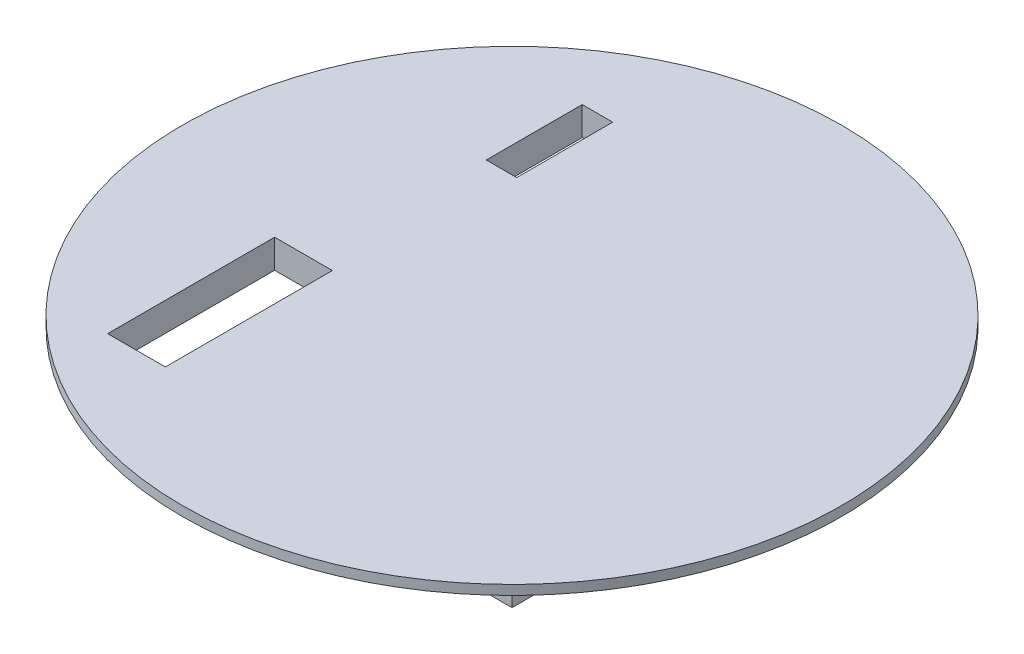
from build123d import *

# Parameters (mm, degrees)
SKETCH1_W           = 47
SKETCH1_H           = 47
SKETCH1_W_2         = 6.040926981
SKETCH1_H_2         = 17.482076569
SKETCH1_W_3         = 3.189765803
SKETCH1_H_3         = 10.04776228
BOSS_EXTRUDE2_DEPTH = 2
SKETCH6_R           = 34.5
SKETCH6_W           = 3.189765803
SKETCH6_H           = 10.04776228
SKETCH6_W_2         = 6.040926981
SKETCH6_H_2         = 17.482076569
BOSS_EXTRUDE4_DEPTH = 1


with BuildPart() as part:
    # Sketch1 → Boss-Extrude2 (new body)
    with BuildSketch(Plane(origin=(0, 0, 0), x_dir=(1, 0, 0), z_dir=(0, 1, 0))):
        Rectangle(SKETCH1_W, SKETCH1_H)
        with Locations((-16.490815369, -14.078790897)):
            Rectangle(SKETCH1_W_2, SKETCH1_H_2, mode=Mode.SUBTRACT)
        with Locations((-13.840536858, 17.764090865)):
            Rectangle(SKETCH1_W_3, SKETCH1_H_3, mode=Mode.SUBTRACT)
    extrude(amount=BOSS_EXTRUDE2_DEPTH)

    # Sketch6 → Boss-Extrude4 (add)
    with BuildSketch(Plane(origin=(0, 2, 0), x_dir=(1, 0, 0), z_dir=(0, 1, 0))):
        with Locations(Location((0, 0, 0), (0, 0, 270))):
            Circle(SKETCH6_R)
        with Locations((-13.840536858, 17.764090865)):
            Rectangle(SKETCH6_W, SKETCH6_H, mode=Mode.SUBTRACT)
        with Locations((-16.490815369, -14.078790897)):
            Rectangle(SKETCH6_W_2, SKETCH6_H_2, mode=Mode.SUBTRACT)
    extrude(amount=BOSS_EXTRUDE4_DEPTH)


solid = part.part
